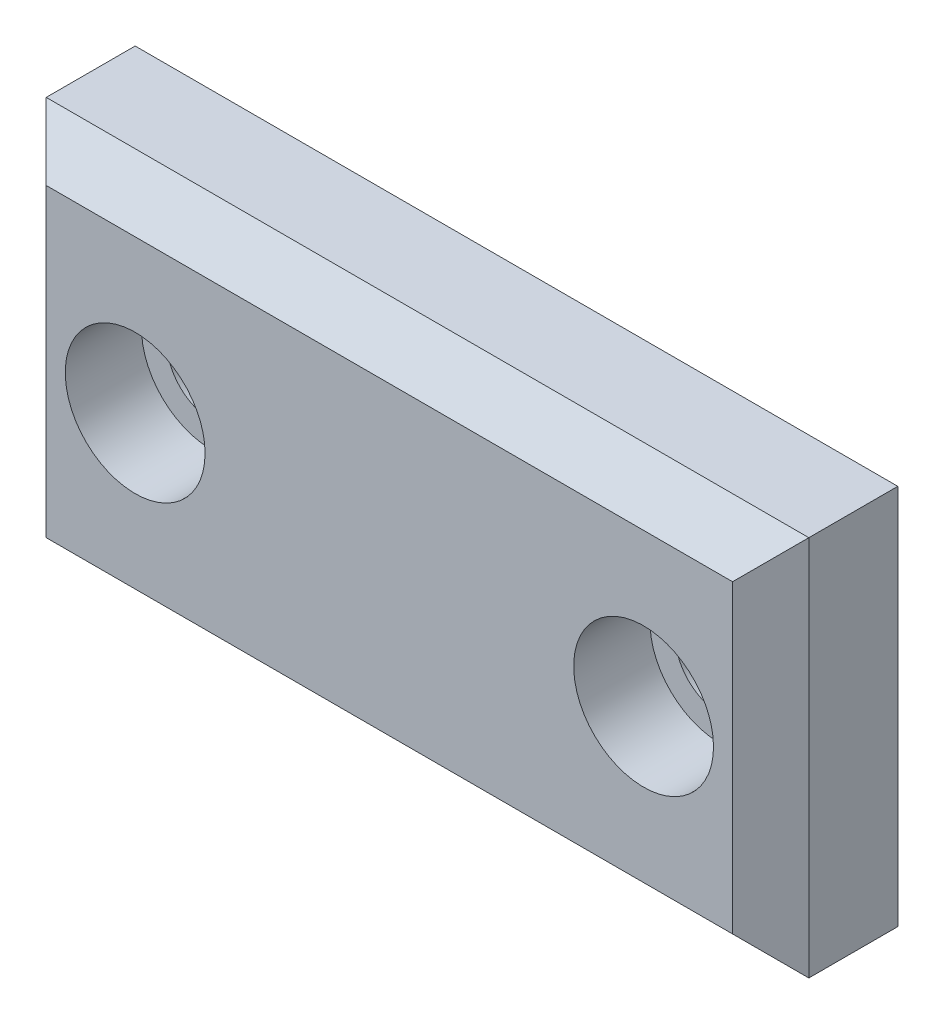
from build123d import *

# Parameters (mm, degrees)
SKETCH_1_W          = 60
SKETCH_1_H          = 30
EXTRUDE_1_DEPTH     = 10
CHAMFER_1_SIZE      = 3
SKETCH_2_R          = 3.5
CUT_EXTRUDE_1_DEPTH = 36
SKETCH_3_R          = 5.5
CUT_EXTRUDE_2_DEPTH = 6


with BuildPart() as part:
    # 草图1 → 凸台-拉伸1 (new body)
    with BuildSketch(Plane.XY):
        Rectangle(SKETCH_1_W, SKETCH_1_H)
    extrude(amount=EXTRUDE_1_DEPTH)

    # 倒角1
    chamfer_1_edges = [part.edges().sort_by_distance(p)[0] for p in [
        (-30, 0, 10),
        (0, -15, 10),
        (30, 0, 10),
        (0, 15, 10),
    ]]
    chamfer(chamfer_1_edges, length=CHAMFER_1_SIZE)

    # 草图2 → 切除-拉伸1 (cut, through all)
    with BuildSketch(Plane.XY.offset(10)):
        with Locations((-20, 0)):
            Circle(SKETCH_2_R)
        with Locations((20, 0)):
            Circle(SKETCH_2_R)
    extrude(amount=-CUT_EXTRUDE_1_DEPTH, mode=Mode.SUBTRACT)

    # 草图3 → 切除-拉伸2 (cut)
    with BuildSketch(Plane.XY.offset(10)):
        with Locations((-20, 0)):
            Circle(SKETCH_3_R)
        with Locations((20, 0)):
            Circle(SKETCH_3_R)
    extrude(amount=-CUT_EXTRUDE_2_DEPTH, mode=Mode.SUBTRACT)


solid = part.part
